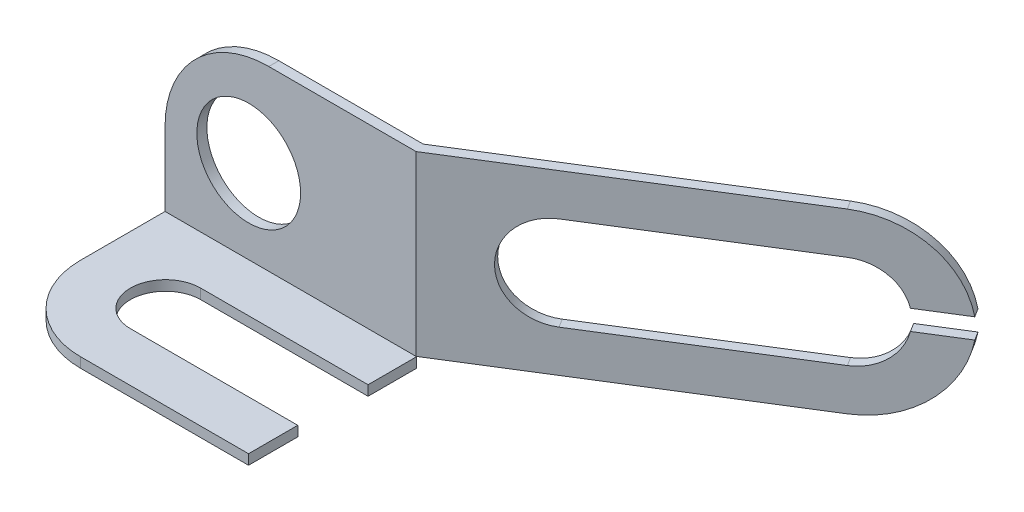
from build123d import *

# Parameters (mm, degrees)
BOSS_EXTRUDE3_DEPTH = 0.06
SKETCH2_R           = 0.31
BOSS_EXTRUDE4_DEPTH = 0.06
BOSS_EXTRUDE5_DEPTH = 0.06


with BuildPart() as part:
    # Sketch1 → Boss-Extrude3 (new body)
    with BuildSketch(Plane(origin=(0, 0, 0), x_dir=(1, 0, 0), z_dir=(0, 1, 0))):
        with BuildLine():
            Line((-0.003067481, -0.504131751), (1, -0.504131751))
            Line((1, -0.504131751), (1, -0.21))
            Line((1, -0.21), (0, -0.21))
            ThreePointArc((0, -0.21), (-0.209999993, 0), (0, 0.209999993))
            Line((0, 0.209999993), (1, 0.209999993))
            Line((1, 0.209999993), (1, 0.5))
            Line((1, 0.5), (-0.503067481, 0.5))
            Line((-0.503067481, 0.5), (-0.503067481, -0.004131751))
            ThreePointArc((-0.503067481, -0.004131751), (-0.356620872, -0.357685141), (-0.003067481, -0.504131751))
        make_face()
    extrude(amount=-BOSS_EXTRUDE3_DEPTH)


with BuildPart() as body_2:
    # Sketch2 → Boss-Extrude4 (new body)
    with BuildSketch(Plane.XY.offset(-0.5)):
        with BuildLine():
            Line((-0.503067481, 0), (-0.503067481, 0.44))
            ThreePointArc((-0.503067481, 0.44), (-0.321473686, 0.878406204), (0.116932519, 1.06))
            Line((0.116932519, 1.06), (0.996932519, 1.06))
            Line((0.996932519, 1.06), (0.996932519, 0))
            Line((0.996932519, 0), (-0.503067481, 0))
        make_face()
        with Locations((-0.003067481, 0.5)):
            Circle(SKETCH2_R, mode=Mode.SUBTRACT)
    extrude(amount=-BOSS_EXTRUDE4_DEPTH)

    # Sketch3 → Boss-Extrude5 (add)
    with BuildSketch(Plane(origin=(0.055254522, 0, 0.08842572), x_dir=(0, -1, 0), z_dir=(0.529919264233203, 0, 0.8480480961564272))):
        with BuildLine():
            Line((-1.06, 1.110406357), (-1.06, 2.980406357))
            ThreePointArc((-1.06, 2.980406357), (-0.92661458, 3.3431735), (-0.59, 3.533126901))
            Line((-0.59, 3.533126901), (-0.59, 3.253902243))
            ThreePointArc((-0.59, 3.253902243), (-0.748174242, 3.155905644), (-0.81, 2.980406357))
            Line((-0.81, 2.980406357), (-0.81, 1.730406357))
            ThreePointArc((-0.81, 1.730406357), (-0.53, 1.450406357), (-0.25, 1.730406357))
            Line((-0.25, 1.730406357), (-0.25, 2.980406357))
            ThreePointArc((-0.25, 2.980406357), (-0.311825758, 3.155905644), (-0.47, 3.253902243))
            Line((-0.47, 3.253902243), (-0.47, 3.533126901))
            ThreePointArc((-0.47, 3.533126901), (-0.13338542, 3.3431735), (0, 2.980406357))
            Line((0, 2.980406357), (0, 1.110406357))
            Line((0, 1.110406357), (-1.06, 1.110406357))
        make_face()
    extrude(amount=-BOSS_EXTRUDE5_DEPTH)


solid = Compound([part.part, body_2.part])
